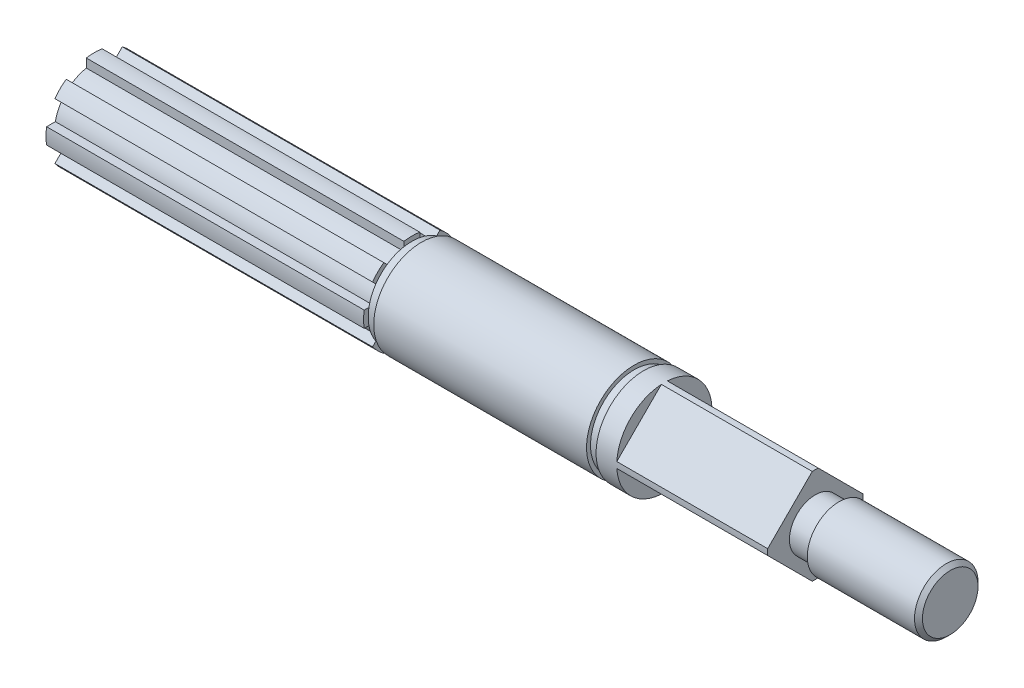
from build123d import *

# Parameters (mm, degrees)
SKETCH_1_R               = 7
EXTRUDE_1_DEPTH          = 40
CUT_EXTRUDE_1_DEPTH      = 40
PATTERN_CIRCULAR_1_COUNT = 8
SKETCH_3_R               = 5.5
EXTRUDE_2_DEPTH          = 1.2
SKETCH_4_R               = 6
EXTRUDE_3_DEPTH          = 26.8
SKETCH_5_R               = 5.5
EXTRUDE_4_DEPTH          = 1.2
SKETCH_6_R               = 6
EXTRUDE_5_DEPTH          = 2.6
EXTRUDE_6_DEPTH          = 19
SKETCH_8_R               = 3.25
EXTRUDE_7_DEPTH          = 3
SKETCH_9_R               = 4
EXTRUDE_8_DEPTH          = 14
CHAMFER_1_SIZE           = 0.5
SKETCH_10_OUTSIDE_W      = 36.586
SKETCH_10_OUTSIDE_H      = 36.586
SKETCH_10_OUTSIDE_R      = 6
CUT_EXTRUDE_2_DEPTH      = 22


with BuildPart() as part:
    # 草图1 → 凸台-拉伸1 (new body)
    with BuildSketch(Plane(origin=(0, 0, 0), x_dir=(0, 0, -1), z_dir=(1, 0, 0))):
        Circle(SKETCH_1_R)
    extrude(amount=EXTRUDE_1_DEPTH)

    # 草图2 → 切除-拉伸1 (cut)
    with BuildSketch(Plane(origin=(40, 0, 0), x_dir=(0, 0, -1), z_dir=(1, 0, 0))):
        with BuildLine():
            Line((1, 6), (1, 4.898979486))
            ThreePointArc((1, 4.898979486), (1.463400625, 4.78105204), (1.913417162, 4.619397663))
            Line((1.913417162, 4.619397663), (3.826834324, 9.238795325))
            ThreePointArc((3.826834324, 9.238795325), (0, 10), (-3.826834324, 9.238795325))
            Line((-3.826834324, 9.238795325), (-1.913417162, 4.619397663))
            ThreePointArc((-1.913417162, 4.619397663), (-1.463400625, 4.78105204), (-1, 4.898979486))
            Line((-1, 4.898979486), (-1, 6))
            ThreePointArc((-1, 6), (0, 6.08276253), (1, 6))
        make_face()
    cut_extrude_1 = extrude(amount=-CUT_EXTRUDE_1_DEPTH, mode=Mode.SUBTRACT)

    # 阵列(圆周)1: 切除-拉伸1 ×8 about axis
    pattern_circular_1_axis = Axis((88.99, 0, 0), (-1, 0, 0))
    for i in range(1, PATTERN_CIRCULAR_1_COUNT):
        add(cut_extrude_1.rotate(pattern_circular_1_axis, i * 360 / PATTERN_CIRCULAR_1_COUNT), mode=Mode.SUBTRACT)

    # 草图3 → 凸台-拉伸2 (add)
    with BuildSketch(Plane(origin=(40, 0, 0), x_dir=(0, 0, -1), z_dir=(1, 0, 0))):
        Circle(SKETCH_3_R)
    extrude(amount=EXTRUDE_2_DEPTH)

    # 草图4 → 凸台-拉伸3 (add)
    with BuildSketch(Plane(origin=(41.2, 0, 0), x_dir=(0, 0, -1), z_dir=(1, 0, 0))):
        Circle(SKETCH_4_R)
    extrude(amount=EXTRUDE_3_DEPTH)

    # 草图5 → 凸台-拉伸4 (add)
    with BuildSketch(Plane(origin=(68, 0, 0), x_dir=(0, 0, -1), z_dir=(1, 0, 0))):
        Circle(SKETCH_5_R)
    extrude(amount=EXTRUDE_4_DEPTH)

    # 草图6 → 凸台-拉伸5 (add)
    with BuildSketch(Plane(origin=(69.2, 0, 0), x_dir=(0, 0, -1), z_dir=(1, 0, 0))):
        Circle(SKETCH_6_R)
    extrude(amount=EXTRUDE_5_DEPTH)

    # 草图7 → 凸台-拉伸6 (add)
    with BuildSketch(Plane(origin=(71.8, 0, 0), x_dir=(0, 0, -1), z_dir=(1, 0, 0))):
        Polygon((0, -6.363961031), (6.363961031, 0), (0, 6.363961031), (-6.363961031, 0), align=None)
    extrude(amount=EXTRUDE_6_DEPTH)

    # 草图8 → 凸台-拉伸7 (add)
    with BuildSketch(Plane(origin=(90.8, 0, 0), x_dir=(0, 0, -1), z_dir=(1, 0, 0))):
        Circle(SKETCH_8_R)
    extrude(amount=EXTRUDE_7_DEPTH)

    # 草图9 → 凸台-拉伸8 (add)
    with BuildSketch(Plane(origin=(93.8, 0, 0), x_dir=(0, 0, -1), z_dir=(1, 0, 0))):
        Circle(SKETCH_9_R)
    extrude(amount=EXTRUDE_8_DEPTH)

    # 倒角1
    chamfer_1_edges = [part.edges().sort_by_distance(p)[0] for p in [
        (107.8, 0, 4),
    ]]
    chamfer(chamfer_1_edges, length=CHAMFER_1_SIZE)

    # 草图10 outside → 切除-拉伸2 (cut)
    with BuildSketch(Plane(origin=(71.8, 0, 0), x_dir=(0, 0, -1), z_dir=(1, 0, 0))):
        Rectangle(SKETCH_10_OUTSIDE_W, SKETCH_10_OUTSIDE_H)
        Circle(SKETCH_10_OUTSIDE_R, mode=Mode.SUBTRACT)
    extrude(amount=CUT_EXTRUDE_2_DEPTH, mode=Mode.SUBTRACT)


solid = part.part
